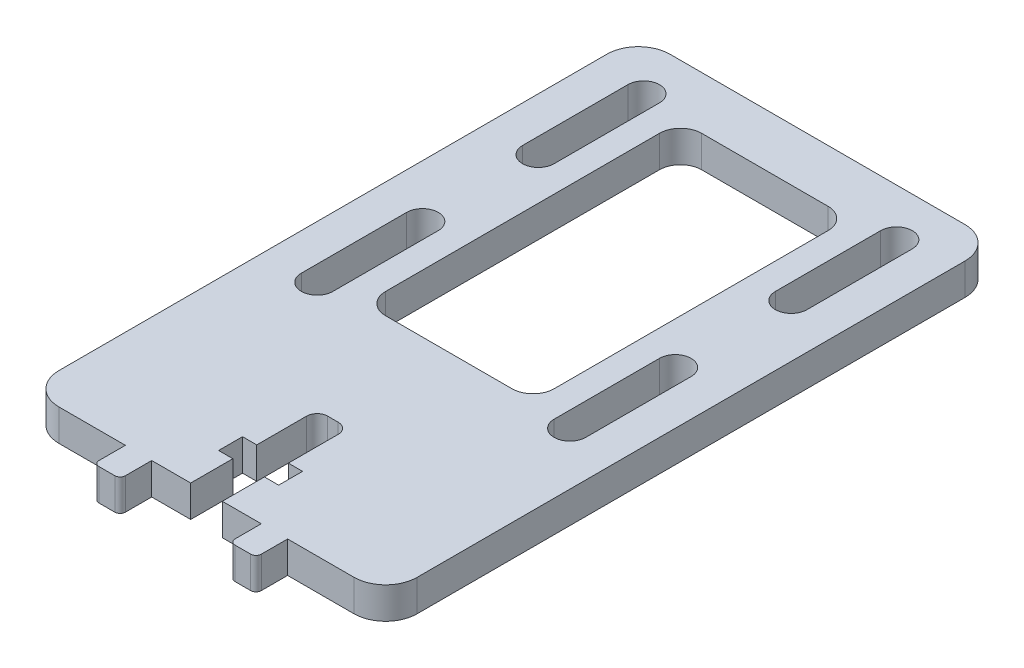
from build123d import *

# Parameters (mm, degrees)
SKETCH1_W               = 34
SKETCH1_H               = 58
BOSS_EXTRUDE1_DEPTH     = 1.5
CUT_EXTRUDE1_DEPTH      = 34.648922717
CUT_EXTRUDE1_DEPTH_BACK = 34.648922717
CUT_EXTRUDE2_DEPTH      = 34.648922717
CUT_EXTRUDE2_DEPTH_BACK = 34.648922717
BOSS_EXTRUDE3_DEPTH     = 1.5
FILLET1_R               = 3


with BuildPart() as part:
    # Sketch1 → Boss-Extrude1 (new, symmetric)
    with BuildSketch(Plane(origin=(0, 0, 0), x_dir=(1, 0, 0), z_dir=(0, 1, 0))):
        Rectangle(SKETCH1_W, SKETCH1_H)
    extrude(amount=BOSS_EXTRUDE1_DEPTH, both=True)

    # Sketch3 → Cut-Extrude1 (cut, two sides: drawn at the far end of the back side and taken through both)
    with BuildSketch(Plane(origin=(0, 0, 0), x_dir=(1, 0, 0), z_dir=(0, 1, 0)).offset(-CUT_EXTRUDE1_DEPTH_BACK)):
        with BuildLine():
            Line((-13.5, 14.5), (-13.5, 24.5))
            ThreePointArc((-13.5, 24.5), (-12, 26), (-10.5, 24.5))
            Line((-10.5, 24.5), (-10.5, 14.5))
            ThreePointArc((-10.5, 14.5), (-12, 13), (-13.5, 14.5))
        make_face()
        with BuildLine():
            Line((-13.5, -6.5), (-13.5, 3.5))
            ThreePointArc((-13.5, 3.5), (-12, 5), (-10.5, 3.5))
            Line((-10.5, 3.5), (-10.5, -6.5))
            ThreePointArc((-10.5, -6.5), (-12, -8), (-13.5, -6.5))
        make_face()
        with BuildLine():
            Line((13.5, -6.5), (13.5, 3.5))
            ThreePointArc((13.5, 3.5), (12, 5), (10.5, 3.5))
            Line((10.5, 3.5), (10.5, -6.5))
            ThreePointArc((10.5, -6.5), (12, -8), (13.5, -6.5))
        make_face()
        with BuildLine():
            Line((13.5, 14.5), (13.5, 24.5))
            ThreePointArc((13.5, 24.5), (12, 26), (10.5, 24.5))
            Line((10.5, 24.5), (10.5, 14.5))
            ThreePointArc((10.5, 14.5), (12, 13), (13.5, 14.5))
        make_face()
        with BuildLine():
            Line((-6, 24), (6, 24))
            ThreePointArc((6, 24), (7.414213562, 23.414213562), (8, 22))
            Line((8, 22), (8, -4))
            ThreePointArc((8, -4), (7.414213562, -5.414213562), (6, -6))
            Line((6, -6), (-6, -6))
            ThreePointArc((-6, -6), (-7.414213562, -5.414213562), (-8, -4))
            Line((-8, -4), (-8, 22))
            ThreePointArc((-8, 22), (-7.414213562, 23.414213562), (-6, 24))
        make_face()
    extrude(amount=CUT_EXTRUDE1_DEPTH + CUT_EXTRUDE1_DEPTH_BACK, mode=Mode.SUBTRACT)

    # Sketch5 → Cut-Extrude2 (cut, two sides: drawn at the far end of the back side and taken through both)
    with BuildSketch(Plane(origin=(0, 0, 0), x_dir=(1, 0, 0), z_dir=(0, 1, 0)).offset(-CUT_EXTRUDE2_DEPTH_BACK)):
        with BuildLine():
            Line((-1.5, -29), (1.5, -29))
            Line((1.5, -29), (1.5, -25))
            Line((1.5, -25), (2.85, -25))
            Line((2.85, -25), (2.85, -22.73))
            Line((2.85, -22.73), (1.5, -22.73))
            Line((1.5, -22.73), (1.5, -18))
            ThreePointArc((1.5, -18), (1.207106781, -17.292893219), (0.5, -17))
            Line((0.5, -17), (-0.5, -17))
            ThreePointArc((-0.5, -17), (-1.207106781, -17.292893219), (-1.5, -18))
            Line((-1.5, -18), (-1.5, -22.73))
            Line((-1.5, -22.73), (-2.85, -22.73))
            Line((-2.85, -22.73), (-2.85, -25))
            Line((-2.85, -25), (-1.5, -25))
            Line((-1.5, -25), (-1.5, -29))
        make_face()
    extrude(amount=CUT_EXTRUDE2_DEPTH + CUT_EXTRUDE2_DEPTH_BACK, mode=Mode.SUBTRACT)

    # Sketch8 → Boss-Extrude3 (add, symmetric)
    with BuildSketch(Plane(origin=(0, 0, 0), x_dir=(1, 0, 0), z_dir=(0, 1, 0))):
        with BuildLine():
            Line((-7.7, -29), (-5.2, -29))
            Line((-5.2, -29), (-5.2, -31.5))
            ThreePointArc((-5.2, -31.5), (-5.346446609, -31.853553391), (-5.7, -32))
            Line((-5.7, -32), (-7.2, -32))
            ThreePointArc((-7.2, -32), (-7.553553391, -31.853553391), (-7.7, -31.5))
            Line((-7.7, -31.5), (-7.7, -29))
        make_face()
        with BuildLine():
            Line((5.2, -29), (5.2, -31.5))
            ThreePointArc((5.2, -31.5), (5.346446609, -31.853553391), (5.7, -32))
            Line((5.7, -32), (7.2, -32))
            ThreePointArc((7.2, -32), (7.553553391, -31.853553391), (7.7, -31.5))
            Line((7.7, -31.5), (7.7, -29))
            Line((7.7, -29), (5.2, -29))
        make_face()
    extrude(amount=BOSS_EXTRUDE3_DEPTH, both=True)

    # Fillet1
    fillet1_edges = [part.edges().sort_by_distance(p)[0] for p in [
        (-17, 0, -29),
        (17, 0, -29),
        (17, 0, 29),
        (-17, 0, 29),
    ]]
    fillet(fillet1_edges, radius=FILLET1_R)


solid = part.part
